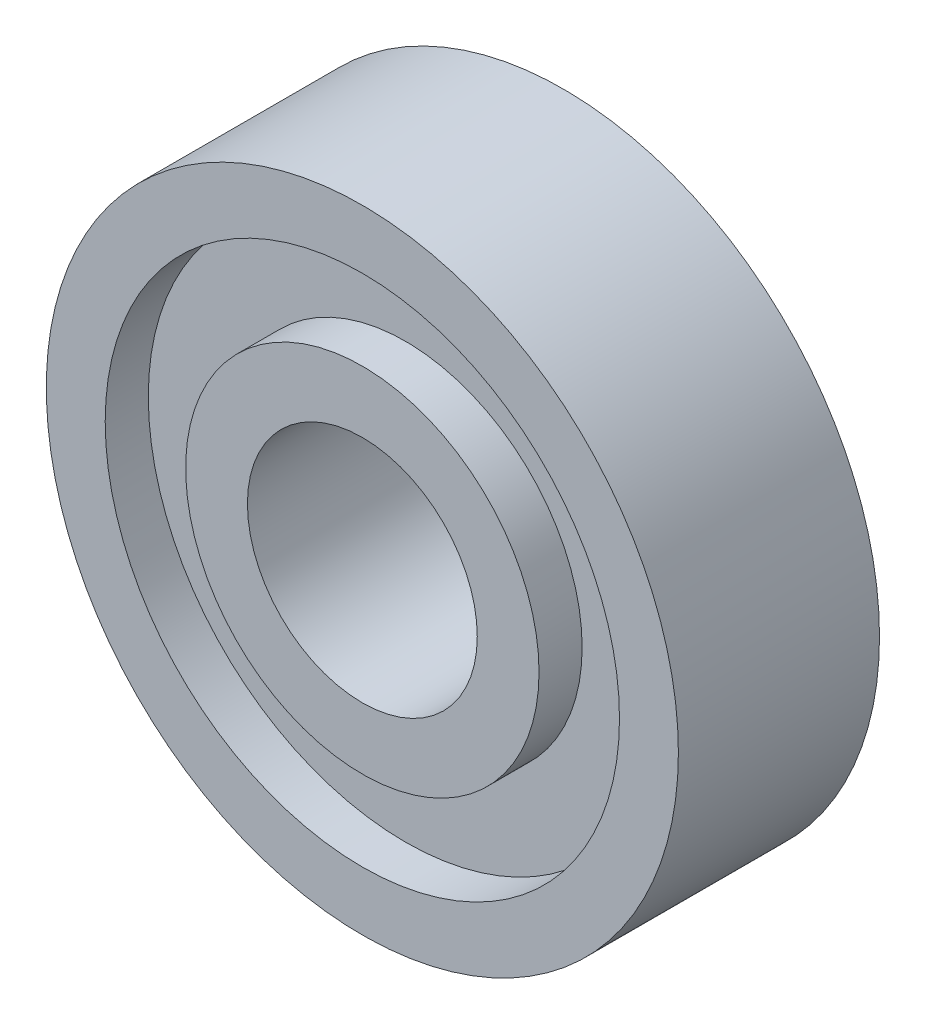
from build123d import *

# Parameters (mm, degrees)
SALIENTE_EXTRUIR1_DEPTH        = 3.5
SALIENTE_EXTRUIR1_DEPTH_BACK   = 3.5
CROQUIS1_R                     = 6.15
CROQUIS1_R_2                   = 4
SALIENTE_EXTRUIR1_2_DEPTH      = 3.5
SALIENTE_EXTRUIR1_2_DEPTH_BACK = 3.5
CROQUIS1_R_3                   = 11
CROQUIS1_R_4                   = 8.95
SALIENTE_EXTRUIR2_DEPTH        = 2
SALIENTE_EXTRUIR2_DEPTH_BACK   = 2
CROQUIS1_3_R                   = 8.95
CROQUIS1_3_R_2                 = 6.15


with BuildPart() as part:
    # Croquis1 → Saliente-Extruir1 (new, two sides: drawn at the far end of the back side and taken through both)
    with BuildSketch(Plane.XY.offset(-SALIENTE_EXTRUIR1_DEPTH_BACK)):
        Circle(CROQUIS1_R)
        Circle(CROQUIS1_R_2, mode=Mode.SUBTRACT)
    extrude(amount=SALIENTE_EXTRUIR1_DEPTH + SALIENTE_EXTRUIR1_DEPTH_BACK)



with BuildPart() as body_2:
    # Croquis1 → Saliente-Extruir1 2 (new, two sides: drawn at the far end of the back side and taken through both)
    with BuildSketch(Plane.XY.offset(-SALIENTE_EXTRUIR1_2_DEPTH_BACK)):
        Circle(CROQUIS1_R_3)
        Circle(CROQUIS1_R_4, mode=Mode.SUBTRACT)
    extrude(amount=SALIENTE_EXTRUIR1_2_DEPTH + SALIENTE_EXTRUIR1_2_DEPTH_BACK)


with BuildPart() as part_1:
    add(part.part)

    add(body_2.part)  # Saliente-Extruir2 merges body 2
    # Croquis1<3> → Saliente-Extruir2 (add, two sides: drawn at the far end of the back side and taken through both)
    with BuildSketch(Plane.XY.offset(-SALIENTE_EXTRUIR2_DEPTH_BACK)):
        Circle(CROQUIS1_3_R)
        Circle(CROQUIS1_3_R_2, mode=Mode.SUBTRACT)
    extrude(amount=SALIENTE_EXTRUIR2_DEPTH + SALIENTE_EXTRUIR2_DEPTH_BACK)


solid = part_1.part
